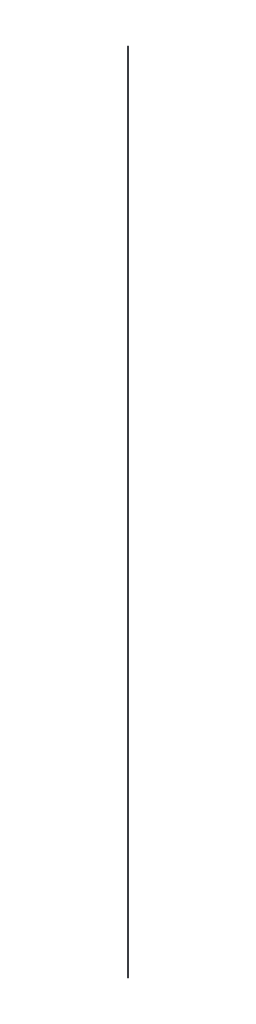
from build123d import *

# Parameters (mm, degrees)
ESBO_O2_R                = 1
RESSALTO_EXTRUS_O1_DEPTH = 3000


with BuildPart() as part:
    # Esboço2 → Ressalto-extrusão1 (new body)
    with BuildSketch(Plane(origin=(0, 0, 0), x_dir=(1, 0, 0), z_dir=(0, 1, 0))):
        with Locations(Location((0, 0, 0), (0, 0, 270))):
            Circle(ESBO_O2_R)
    extrude(amount=RESSALTO_EXTRUS_O1_DEPTH)


solid = part.part
